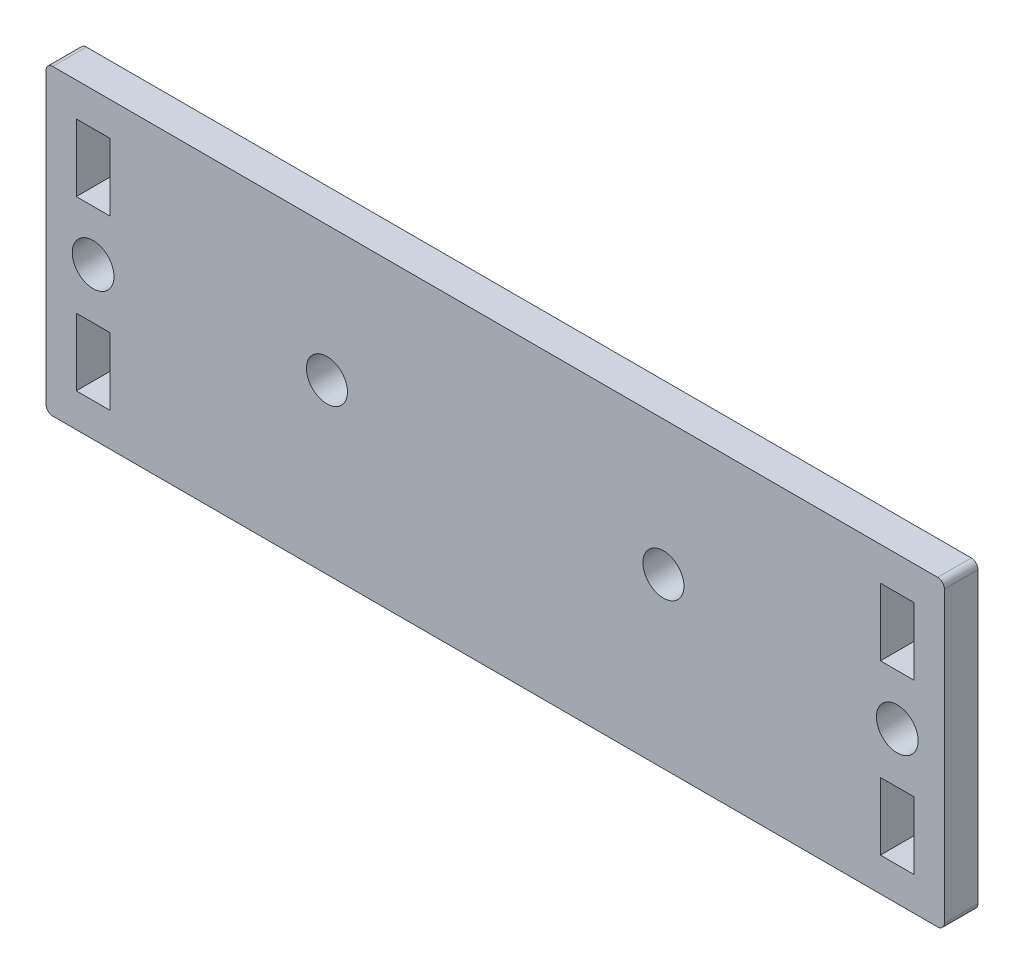
from build123d import *

# Parameters (mm, degrees)
SKETCH1_W           = 133.5
SKETCH1_H           = 45
SKETCH1_R           = 3.05
SKETCH1_R_2         = 3.1
SKETCH1_W_2         = 5
SKETCH1_H_2         = 10
BOSS_EXTRUDE1_DEPTH = 5
FILLET1_R           = 1


with BuildPart() as part:
    # Sketch1 → Boss-Extrude1 (new body)
    with BuildSketch(Plane.XY):
        Rectangle(SKETCH1_W, SKETCH1_H)
        with Locations((25, 2.5)):
            Circle(SKETCH1_R, mode=Mode.SUBTRACT)
        with Locations(Location((-25, 2.5, 0), (0, 0, 180))):
            Circle(SKETCH1_R, mode=Mode.SUBTRACT)
        with Locations((-59.75, 0)):
            Circle(SKETCH1_R_2, mode=Mode.SUBTRACT)
        with Locations(Location((59.75, 0, 0), (0, 0, 180))):
            Circle(SKETCH1_R_2, mode=Mode.SUBTRACT)
        with Locations((-59.75, -12.5)):
            Rectangle(SKETCH1_W_2, SKETCH1_H_2, mode=Mode.SUBTRACT)
        with Locations((59.75, -12.5)):
            Rectangle(SKETCH1_W_2, SKETCH1_H_2, mode=Mode.SUBTRACT)
        with Locations((-59.75, 12.5)):
            Rectangle(SKETCH1_W_2, SKETCH1_H_2, mode=Mode.SUBTRACT)
        with Locations((59.75, 12.5)):
            Rectangle(SKETCH1_W_2, SKETCH1_H_2, mode=Mode.SUBTRACT)
    extrude(amount=BOSS_EXTRUDE1_DEPTH)

    # Fillet1
    fillet1_edges = [part.edges().sort_by_distance(p)[0] for p in [
        (66.75, -22.5, 2.5),
        (-66.75, -22.5, 2.5),
        (-66.75, 22.5, 2.5),
        (66.75, 22.5, 2.5),
    ]]
    fillet(fillet1_edges, radius=FILLET1_R)


solid = part.part
